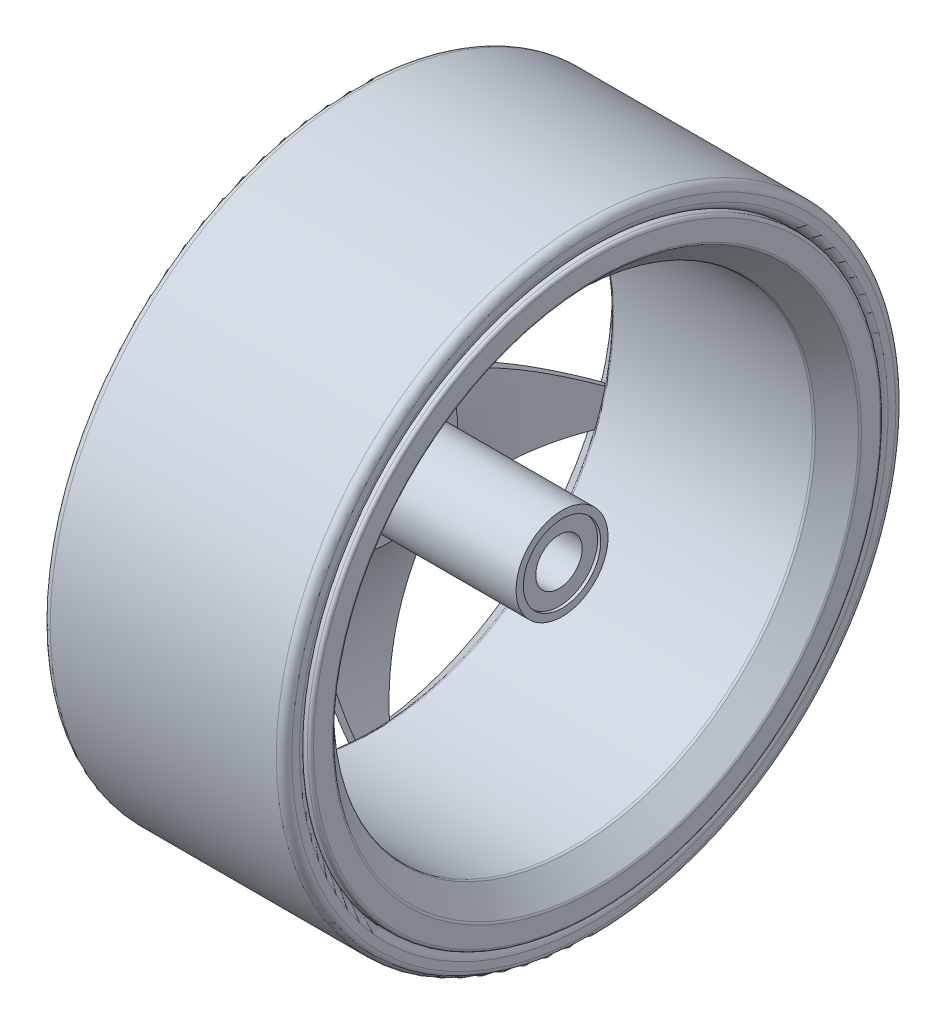
from build123d import *

# Parameters (mm, degrees)
FILLET1_R               = 0.2
CUT_EXTRUDE1_DEPTH      = 10
CUT_EXTRUDE1_DEPTH_BACK = 10
FILLET32_R              = 0.5
BOSS_EXTRUDE1_START     = -0.2
SKETCH6_R               = 2.5
SKETCH6_R_2             = 1.5
BOSS_EXTRUDE1_DEPTH     = 10


with BuildPart() as part:
    # Sketch1 → Revolve1 (revolve)
    with BuildSketch(Plane.XY, mode=Mode.PRIVATE) as revolve1_sk:
        Polygon((-6.5, 15.5), (6.5, 15.5), (8, 17), (8, 18.5), (6.5, 18.5), (5, 16.5), (-5, 16.5), (-6.5, 18.5), (-8, 18.5), (-8, 17), align=None)
    revolve(revolve1_sk.sketch.rotate(Axis((-5, 0, 0), (1, 0, 0)), 90), axis=Axis((-5, 0, 0), (1, 0, 0)))

    # Fillet1
    fillet1_edges = [part.edges().sort_by_distance(p)[0] for p in [
        (6.5, 0, -18.5),
        (8, 0, -18.5),
        (8, 0, -17),
        (6.5, 0, -15.5),
        (-6.5, 0, -15.5),
        (-8, 0, -17),
        (-8, 0, -18.5),
        (-6.5, 0, -18.5),
        (-5, 0, -16.5),
        (5, 0, -16.5),
    ]]
    fillet(fillet1_edges, radius=FILLET1_R)


with BuildPart() as body_2:
    # Sketch2 → Revolve2 (revolve)
    with BuildSketch(Plane.XY, mode=Mode.PRIVATE) as revolve2_sk:
        with BuildLine():
            Line((-6.25, 2.5), (-4.75, 2.5))
            Line((-4.75, 2.5), (-4.75, 0))
            Line((-4.75, 0), (-4, 0))
            Line((-4, 0), (-4, 2.5))
            Line((-4, 2.5), (5.75, 2.5))
            Line((5.75, 2.5), (5.75, 2.972115572))
            Line((5.75, 2.972115572), (-5.5, 2.972115572))
            Line((-5.5, 2.972115572), (-5.5, 4.5))
            ThreePointArc((-5.5, 4.5), (-7.094018021, 9.900543816), (-6.5, 15.5))
            Line((-6.5, 15.5), (-7.030330086, 16.030330086))
            ThreePointArc((-7.030330086, 16.030330086), (-7.78692767, 10.187556391), (-6.25, 4.5))
            Line((-6.25, 4.5), (-6.25, 2.5))
        make_face()
    revolve(revolve2_sk.sketch.rotate(Axis((-5, 0, 0), (1, 0, 0)), 270), axis=Axis((-5, 0, 0), (1, 0, 0)))

    # Sketch4 → Cut-Extrude1 (cut, two sides: drawn at the far end of the back side and taken through both)
    with BuildSketch(Plane(origin=(0, 0, 0), x_dir=(0, 0, -1), z_dir=(1, 0, 0)).offset(-CUT_EXTRUDE1_DEPTH_BACK)):
        with BuildLine():
            Line((8.627256117, 13.510808065), (1.5, 7.530330086))
            ThreePointArc((1.5, 7.530330086), (0, 7.67827267), (-1.5, 7.530330086))
            Line((-1.5, 7.530330086), (-8.627256117, 13.510808065))
            ThreePointArc((-8.627256117, 13.510808065), (0, 16.030330086), (8.627256117, 13.510808065))
        make_face()
        with BuildLine():
            Line((10.183573295, 12.380077447), (6.698244006, 3.753584744))
            ThreePointArc((6.698244006, 3.753584744), (7.302471257, 2.372716743), (7.62529499, 0.900415195))
            Line((7.62529499, 0.900415195), (15.515510805, -4.029938848))
            ThreePointArc((15.515510805, -4.029938848), (15.245749887, 4.953644422), (10.183573295, 12.380077447))
        make_face()
        with BuildLine():
            Line((14.92105054, -5.859499419), (5.639742461, -5.210487134))
            ThreePointArc((5.639742461, -5.210487134), (4.513175439, -6.211853078), (3.212691478, -6.973842891))
            Line((3.212691478, -6.973842891), (0.961856914, -16.001447245))
            ThreePointArc((0.961856914, -16.001447245), (9.422391614, -12.968809465), (14.92105054, -5.859499419))
        make_face()
        with BuildLine():
            Line((-0.961856914, -16.001447245), (-3.212691478, -6.973842891))
            ThreePointArc((-3.212691478, -6.973842891), (-4.513175439, -6.211853078), (-5.639742461, -5.210487134))
            Line((-5.639742461, -5.210487134), (-14.92105054, -5.859499419))
            ThreePointArc((-14.92105054, -5.859499419), (-9.422391614, -12.968809465), (-0.961856914, -16.001447245))
        make_face()
        with BuildLine():
            Line((-15.515510805, -4.029938848), (-7.62529499, 0.900415195))
            ThreePointArc((-7.62529499, 0.900415195), (-7.302471257, 2.372716743), (-6.698244006, 3.753584744))
            Line((-6.698244006, 3.753584744), (-10.183573295, 12.380077447))
            ThreePointArc((-10.183573295, 12.380077447), (-15.245749887, 4.953644422), (-15.515510805, -4.029938848))
        make_face()
    extrude(amount=CUT_EXTRUDE1_DEPTH + CUT_EXTRUDE1_DEPTH_BACK, mode=Mode.SUBTRACT)

    # Combine1: union part
    add(part.part)

    # Fillet32
    fillet32_edges = [body_2.edges().sort_by_distance(p)[0] for p in [
        (-6.25, 0, 2.5),
        (-4.75, 0, 2.5),
    ]]
    fillet(fillet32_edges, radius=FILLET32_R)


with BuildPart() as body_2_2:
    # Sketch5 → Revolve3 (revolve)
    with BuildSketch(Plane.XY, mode=Mode.PRIVATE) as revolve3_sk:
        with BuildLine():
            Line((7.3, 20), (-7.3, 20))
            ThreePointArc((-7.3, 20), (-7.653553391, 19.853553391), (-7.8, 19.5))
            Line((-7.8, 19.5), (-7.8, 19))
            ThreePointArc((-7.8, 19), (-7.653553391, 18.646446609), (-7.3, 18.5))
            Line((-7.3, 18.5), (-6.5, 18.5))
            Line((-6.5, 18.5), (-5, 16.5))
            Line((-5, 16.5), (5, 16.5))
            Line((5, 16.5), (6.6, 18.5))
            Line((6.6, 18.5), (7.3, 18.5))
            ThreePointArc((7.3, 18.5), (7.653553391, 18.646446609), (7.8, 19))
            Line((7.8, 19), (7.8, 19.5))
            ThreePointArc((7.8, 19.5), (7.653553391, 19.853553391), (7.3, 20))
        make_face()
    revolve(revolve3_sk.sketch.rotate(Axis((-5, 0, 0), (1, 0, 0)), 90), axis=Axis((-5, 0, 0), (1, 0, 0)))


with BuildPart() as body_3:
    # Sketch6 → Boss-Extrude1 (new body)
    with BuildSketch(Plane(origin=(5.75, 0, 0), x_dir=(0, 0, -1), z_dir=(1, 0, 0)).offset(BOSS_EXTRUDE1_START)):
        Circle(SKETCH6_R)
        Circle(SKETCH6_R_2, mode=Mode.SUBTRACT)
    extrude(amount=-BOSS_EXTRUDE1_DEPTH)


solid = Compound([body_2.part, body_2_2.part, body_3.part])
